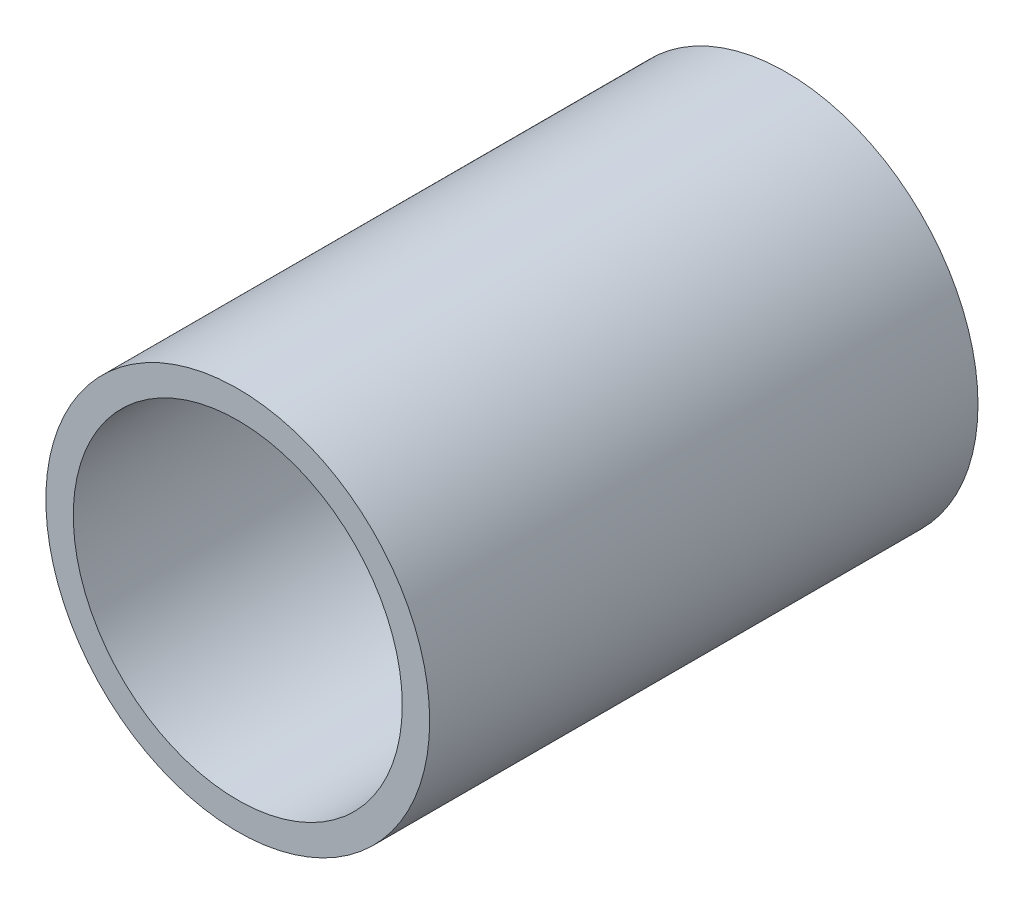
from build123d import *

# Parameters (mm, degrees)
SKETCH2_R           = 8.89
SKETCH2_R_2         = 7.62
BOSS_EXTRUDE1_DEPTH = 25.4


with BuildPart() as part:
    # Sketch2 → Boss-Extrude1 (new body)
    with BuildSketch(Plane.XY):
        Circle(SKETCH2_R)
        Circle(SKETCH2_R_2, mode=Mode.SUBTRACT)
    extrude(amount=BOSS_EXTRUDE1_DEPTH)


solid = part.part
